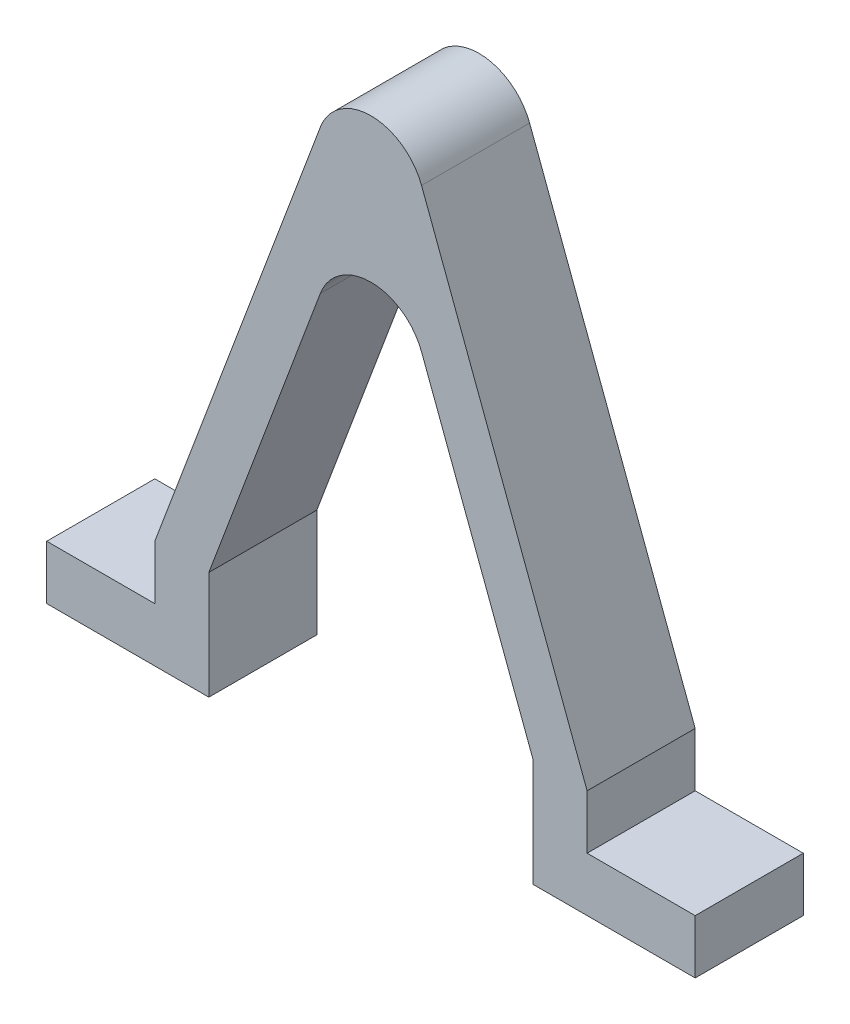
from build123d import *

# Parameters (mm, degrees)
BOSS_EXTRUDE1_DEPTH = 10
FILLET1_R           = 5
FILLET2_R           = 5


with BuildPart() as part:
    # Sketch1 → Boss-Extrude1 (new body)
    with BuildSketch(Plane.XY):
        Polygon((0, 0), (15, 0), (15, 10), (30, 50), (45, 10), (45, 0), (60, 0), (60, 5), (50, 5), (50, 10), (30, 63.333333333), (10, 10), (10, 5), (0, 5), align=None)
    extrude(amount=BOSS_EXTRUDE1_DEPTH)

    # Fillet1
    fillet1_edges = [part.edges().sort_by_distance(p)[0] for p in [
        (30, 50, 5),
    ]]
    fillet(fillet1_edges, radius=FILLET1_R)

    # Fillet2
    fillet2_edges = [part.edges().sort_by_distance(p)[0] for p in [
        (30, 63.333333333, 5),
    ]]
    fillet(fillet2_edges, radius=FILLET2_R)


solid = part.part
